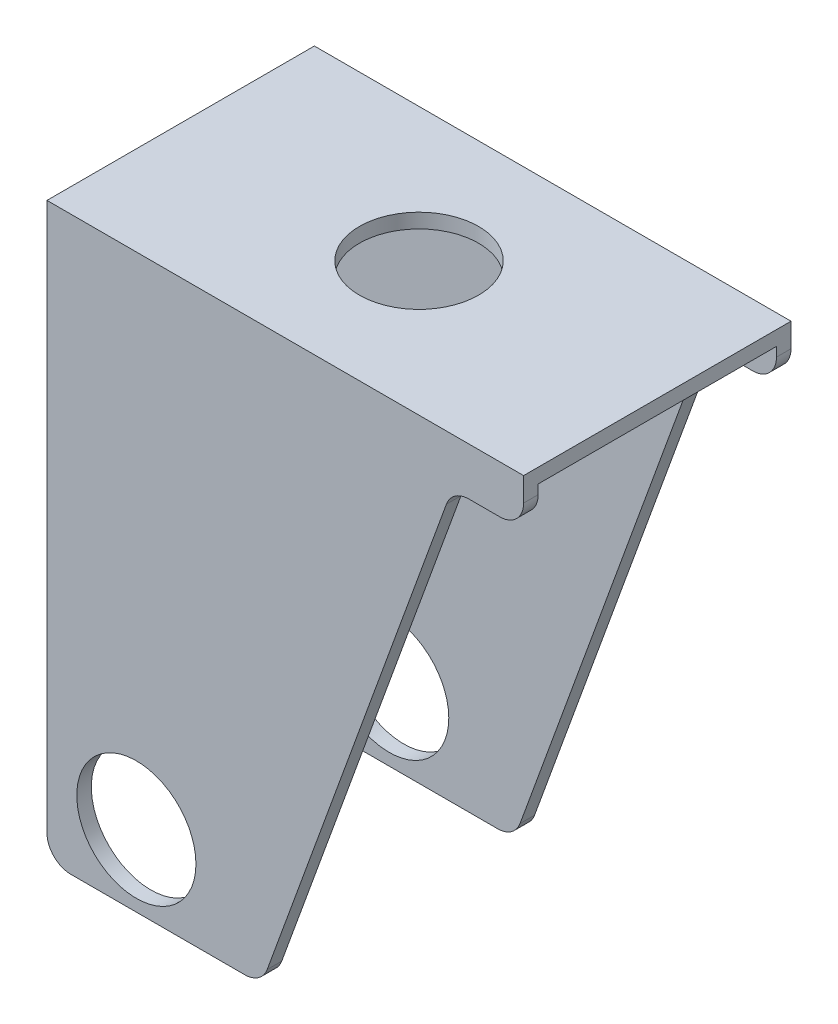
from build123d import *

# Parameters (mm, degrees)
BOSS_EXTRUDE1_DEPTH = 50.8
SKETCH2_R           = 6.35
CUT_EXTRUDE1_DEPTH  = 85.29618662
FILLET1_R           = 2.54
CUT_EXTRUDE2_REACH  = 82.602
SKETCH3_R           = 6.35


with BuildPart() as part:
    # Sketch1 → Boss-Extrude1 (new body)
    with BuildSketch(Plane(origin=(0, 0, 0), x_dir=(0, 0, -1), z_dir=(1, 0, 0))):
        Polygon((12.7, 0), (14.2494, 0), (14.2494, 60.9346), (-14.2494, 60.9346), (-14.2494, 0), (-12.7, 0), (-12.7, 59.3852), (12.7, 59.3852), align=None)
    extrude(amount=BOSS_EXTRUDE1_DEPTH)

    # Sketch2 → Cut-Extrude1 (cut, through all)
    with BuildSketch(Plane.XY.offset(14.2494)):
        with Locations((9.525, 7.62)):
            Circle(SKETCH2_R)
        Polygon((22.86, 0), (50.8, 0), (50.8, 55.8546), (43.18, 55.8546), align=None)
    extrude(amount=-CUT_EXTRUDE1_DEPTH, mode=Mode.SUBTRACT)

    # Fillet1
    fillet1_edges = [part.edges().sort_by_distance(p)[0] for p in [
        (0, 0, -13.4747),
        (50.8, 55.8546, 13.4747),
        (50.8, 55.8546, -13.4747),
        (22.86, 0, -13.4747),
        (22.86, 0, 13.4747),
        (43.18, 55.8546, -13.4747),
        (43.18, 55.8546, 13.4747),
        (0, 0, 13.4747),
    ]]
    fillet(fillet1_edges, radius=FILLET1_R)

    # Sketch3 → Cut-Extrude2 (cut, up to next)
    with BuildSketch(Plane(origin=(0, 60.9346, 0), x_dir=(1, 0, 0), z_dir=(0, 1, 0)), mode=Mode.PRIVATE) as cut_extrude2_sk1:
        with Locations(Location((25.4, 0, 0), (0, 0, 270))):
            Circle(SKETCH3_R)
    cut_extrude2_tool1 = extrude(cut_extrude2_sk1.sketch, amount=-CUT_EXTRUDE2_REACH, mode=Mode.PRIVATE) & part.part
    add(cut_extrude2_tool1.solids().sort_by_distance((25.4, 60.9346, 0))[0], mode=Mode.SUBTRACT)


solid = part.part
